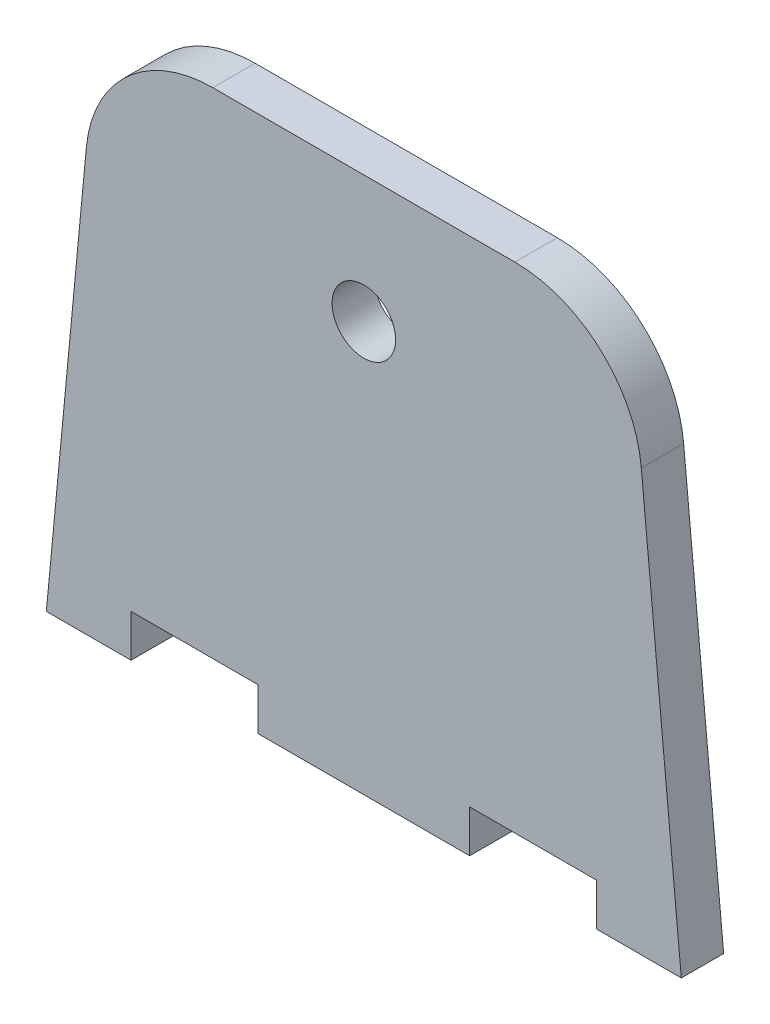
from build123d import *

# Parameters (mm, degrees)
SKETCH1_R           = 2.38125
BOSS_EXTRUDE1_DEPTH = 3.175
SKETCH2_W           = 9.525
SKETCH2_H           = 3.175
CUT_EXTRUDE1_DEPTH  = 47.881796705


with BuildPart() as part:
    # Sketch1 → Boss-Extrude1 (new body)
    with BuildSketch(Plane.XY):
        with BuildLine():
            Line((-11.330339119, 40.259), (11.330339119, 40.259))
            ThreePointArc((11.330339119, 40.259), (17.739736735, 37.779938348), (20.812800106, 31.633198887))
            Line((20.812800106, 31.633198887), (23.8125, 0))
            Line((23.8125, 0), (-23.8125, 0))
            Line((-23.8125, 0), (-20.812800106, 31.633198887))
            ThreePointArc((-20.812800106, 31.633198887), (-17.739736735, 37.779938348), (-11.330339119, 40.259))
        make_face()
        with Locations((0, 30.734)):
            Circle(SKETCH1_R, mode=Mode.SUBTRACT)
    extrude(amount=BOSS_EXTRUDE1_DEPTH)

    # Sketch2 → Cut-Extrude1 (cut, through all)
    with BuildSketch(Plane.XY.offset(3.175)):
        with Locations((-12.7, 1.5875)):
            Rectangle(SKETCH2_W, SKETCH2_H)
        with Locations((12.7, 1.5875)):
            Rectangle(SKETCH2_W, SKETCH2_H)
    extrude(amount=-CUT_EXTRUDE1_DEPTH, mode=Mode.SUBTRACT)


solid = part.part
